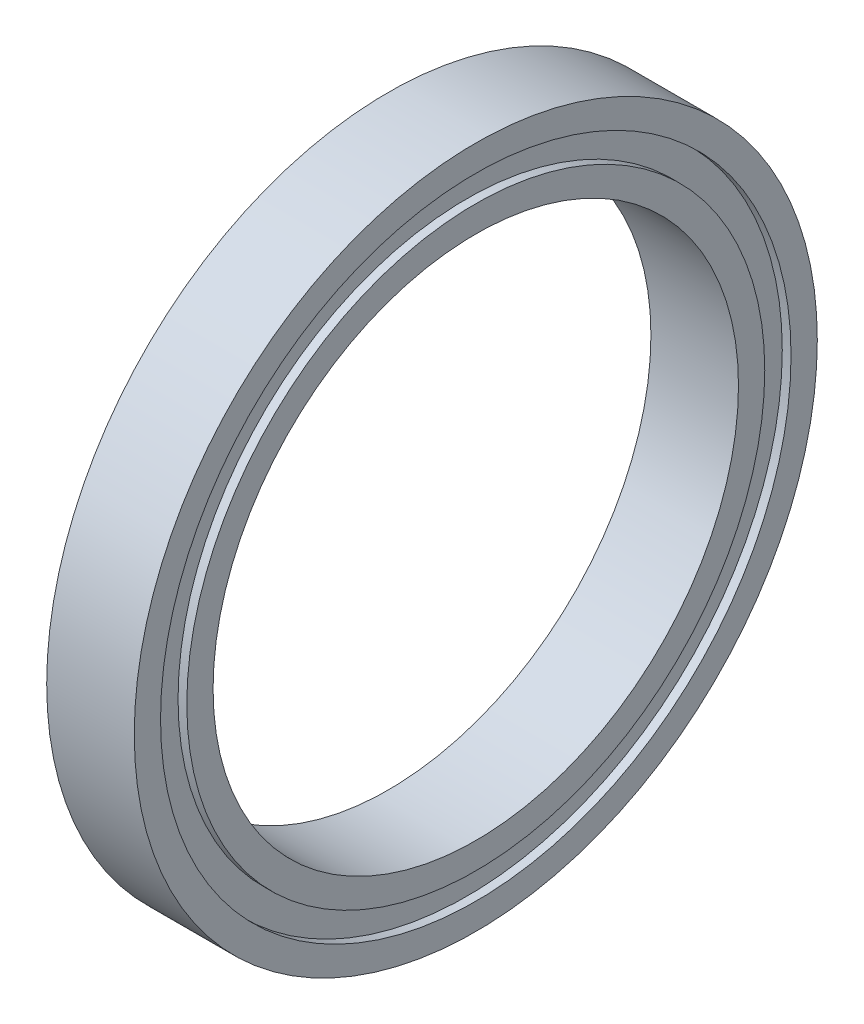
from build123d import *

# Parameters (mm, degrees)
SKETCH_1_R          = 39
SKETCH_1_R_2        = 30
EXTRUDE_1_DEPTH     = 10
SKETCH_2_R          = 36
SKETCH_2_R_2        = 33
CUT_EXTRUDE_1_DEPTH = 1
CUT_EXTRUDE_START   = -1
SKETCH_3_R          = 36
SKETCH_3_R_2        = 33
CUT_EXTRUDE_2_DEPTH = 1


with BuildPart() as part:
    # 草图1 → 凸台-拉伸1 (new body)
    with BuildSketch(Plane(origin=(0, 0, 0), x_dir=(0, 0, -1), z_dir=(1, 0, 0))):
        Circle(SKETCH_1_R)
        Circle(SKETCH_1_R_2, mode=Mode.SUBTRACT)
    extrude(amount=EXTRUDE_1_DEPTH)

    # 草图2 → 切除-拉伸1 (cut)
    with BuildSketch(Plane(origin=(10, 0, 0), x_dir=(0, 0, -1), z_dir=(1, 0, 0))):
        Circle(SKETCH_2_R)
        Circle(SKETCH_2_R_2, mode=Mode.SUBTRACT)
    extrude(amount=-CUT_EXTRUDE_1_DEPTH, mode=Mode.SUBTRACT)

    # 草图3 → 切除-拉伸2 (cut)
    with BuildSketch(Plane.ZY.offset(CUT_EXTRUDE_START)):
        with Locations(Location((0, 0, 0), (0, 0, 180))):
            Circle(SKETCH_3_R)
        with Locations(Location((0, 0, 0), (0, 0, 180))):
            Circle(SKETCH_3_R_2, mode=Mode.SUBTRACT)
    extrude(amount=CUT_EXTRUDE_2_DEPTH, mode=Mode.SUBTRACT)


solid = part.part
